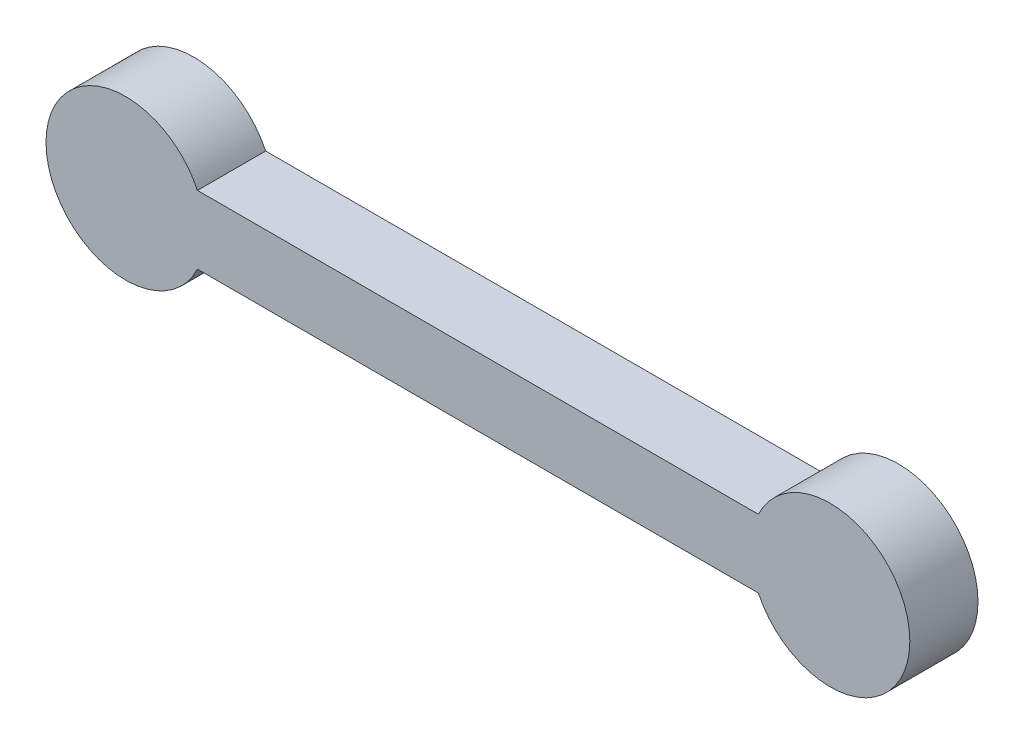
from build123d import *

# Parameters (mm, degrees)
SKETCH1_R           = 3.5
BOSS_EXTRUDE1_DEPTH = 3
SKETCH2_R           = 3.5
BOSS_EXTRUDE2_DEPTH = 3
SKETCH3_W           = 31
SKETCH3_H           = 3
BOSS_EXTRUDE3_DEPTH = 3


with BuildPart() as part:
    # Sketch1 → Boss-Extrude1 (new body)
    with BuildSketch(Plane.XY):
        Circle(SKETCH1_R)
    extrude(amount=BOSS_EXTRUDE1_DEPTH)



with BuildPart() as body_2:
    # Sketch2 → Boss-Extrude2 (new body)
    with BuildSketch(Plane.XY):
        with Locations((31, 0)):
            Circle(SKETCH2_R)
    extrude(amount=BOSS_EXTRUDE2_DEPTH)


with BuildPart() as part_1:
    add(part.part)

    add(body_2.part)  # Boss-Extrude3 merges body 2
    # Sketch3 → Boss-Extrude3 (add)
    with BuildSketch(Plane.XY):
        with Locations((15.5, 0)):
            Rectangle(SKETCH3_W, SKETCH3_H)
    extrude(amount=BOSS_EXTRUDE3_DEPTH)


solid = part_1.part
